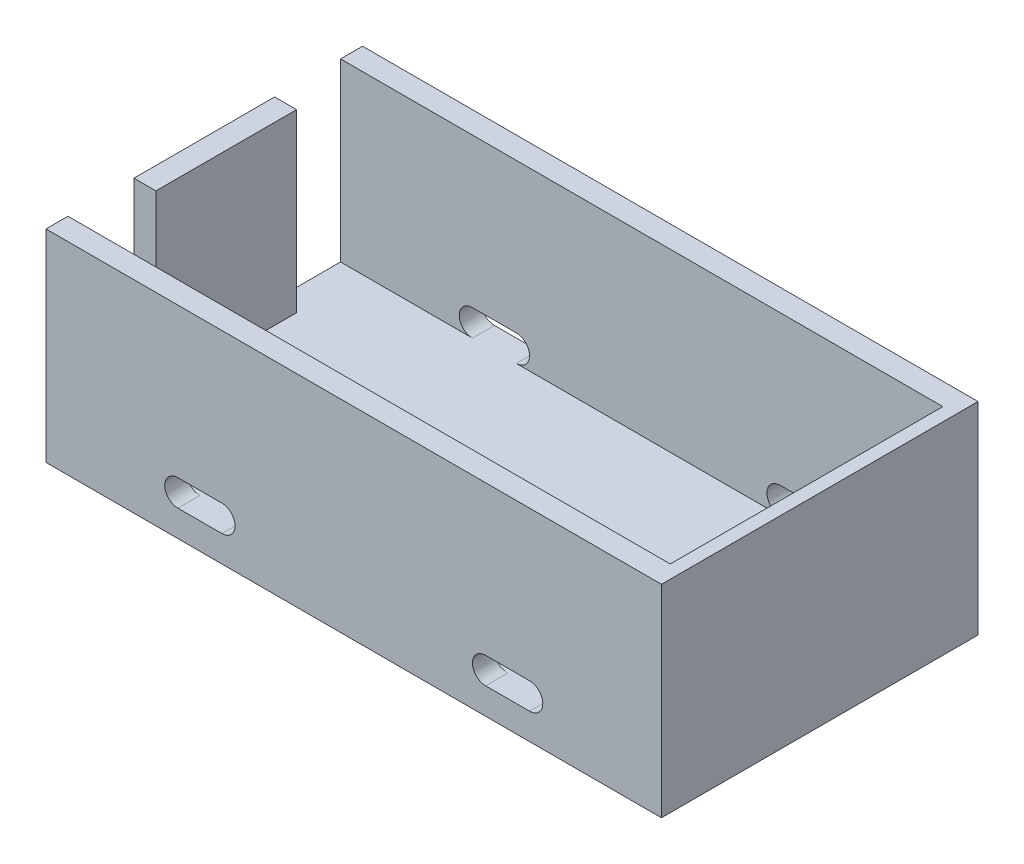
from build123d import *

# Parameters (mm, degrees)
SKETCH1_W               = 1.5
SKETCH1_H               = 31
SKETCH1_W_2             = 2.5
SKETCH1_H_2             = 16
BOSS_EXTRUDE1_DEPTH     = 20
SKETCH2_W               = 70
SKETCH2_H               = 36
BOSS_EXTRUDE2_DEPTH     = 3
CUT_EXTRUDE1_DEPTH      = 82.215762017
CUT_EXTRUDE1_DEPTH_BACK = 82.215762017


with BuildPart() as part:
    # Sketch1 → Boss-Extrude1 (new body)
    with BuildSketch(Plane(origin=(0, 0, 0), x_dir=(1, 0, 0), z_dir=(0, 1, 0))):
        Polygon((70, 36), (0, 36), (0, 33.5), (68.5, 33.5), (70, 33.5), align=None)
        with Locations((69.25, 18)):
            Rectangle(SKETCH1_W, SKETCH1_H)
        Polygon((70, 0), (70, 2.5), (68.5, 2.5), (0, 2.5), (0, 0), align=None)
        with Locations((1.25, 18)):
            Rectangle(SKETCH1_W_2, SKETCH1_H_2)
    extrude(amount=BOSS_EXTRUDE1_DEPTH)

    # Sketch2 → Boss-Extrude2 (add)
    with BuildSketch(Plane.XZ):
        with Locations((35, -18)):
            Rectangle(SKETCH2_W, SKETCH2_H)
    extrude(amount=BOSS_EXTRUDE2_DEPTH)

    # Sketch3 → Cut-Extrude1 (cut, two sides: drawn at the far end of the back side and taken through both)
    with BuildSketch(Plane.XY.offset(-CUT_EXTRUDE1_DEPTH_BACK)):
        with BuildLine():
            Line((15, 3), (20, 3))
            ThreePointArc((20, 3), (21.5, 1.5), (20, 0))
            Line((20, 0), (15, 0))
            ThreePointArc((15, 0), (13.5, 1.5), (15, 3))
        make_face()
        with BuildLine():
            Line((55, 3), (50, 3))
            ThreePointArc((50, 3), (48.5, 1.5), (50, 0))
            Line((50, 0), (55, 0))
            ThreePointArc((55, 0), (56.5, 1.5), (55, 3))
        make_face()
    extrude(amount=CUT_EXTRUDE1_DEPTH + CUT_EXTRUDE1_DEPTH_BACK, mode=Mode.SUBTRACT)


solid = part.part
